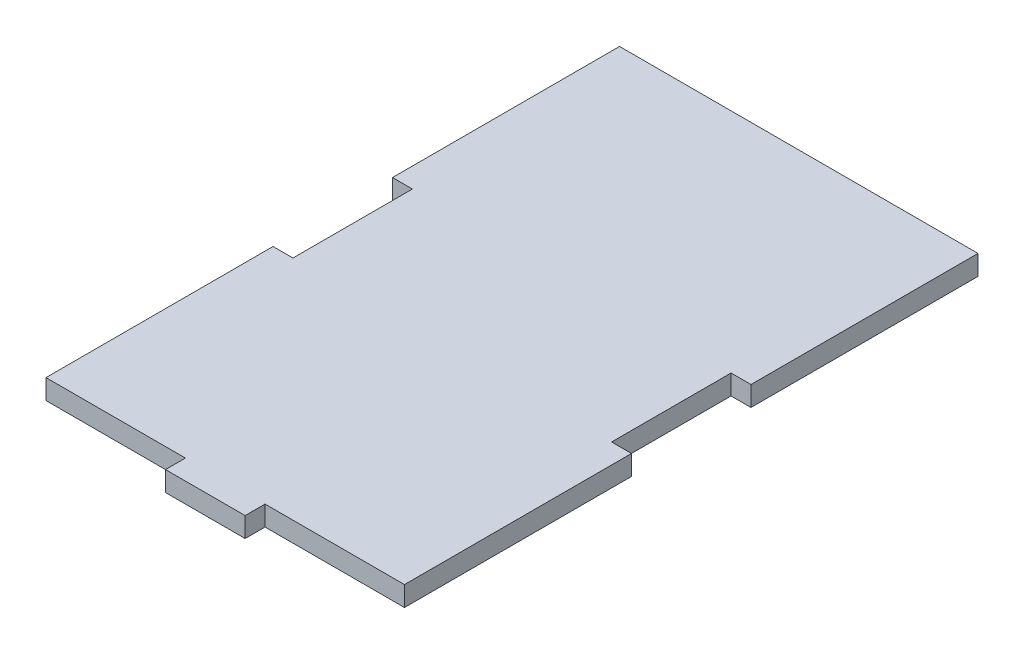
from build123d import *

# Parameters (mm, degrees)
BOSS_EXTRUDE1_DEPTH = 5


with BuildPart() as part:
    # Sketch1 → Boss-Extrude1 (new body)
    with BuildSketch(Plane(origin=(0, 0, 0), x_dir=(1, 0, 0), z_dir=(0, 1, 0))):
        Polygon((-45, 72), (45, 72), (45, 15), (40, 15), (40, -15), (45, -15), (45, -72), (10, -72), (10, -77), (-10, -77), (-10, -72), (-45, -72), (-45, -15), (-40, -15), (-40, 15), (-45, 15), align=None)
    extrude(amount=BOSS_EXTRUDE1_DEPTH)


solid = part.part
